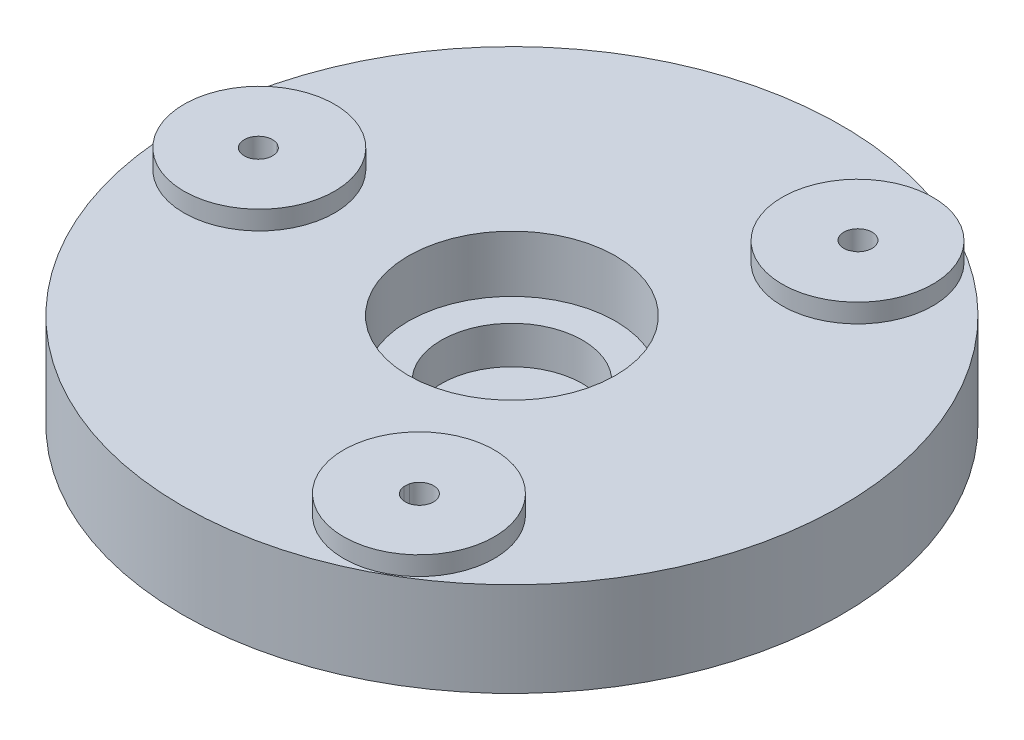
from build123d import *

# Parameters (mm, degrees)
SKETCH1_R                   = 35
BOSS_EXTRUDE1_DEPTH         = 10
SKETCH2_R                   = 11
CUT_EXTRUDE1_DEPTH          = 6
SKETCH3_R                   = 7.5
CUT_EXTRUDE2_DEPTH          = 6
SKETCH4_R                   = 8
BOSS_EXTRUDE2_DEPTH         = 2
CUT_EXTRUDE3_DEPTH          = 21
SKETCH6_R                   = 3.1
CUT_EXTRUDE4_DEPTH          = 4
CIRPATTERN1_COUNT           = 3
CIRPATTERN2_COUNT           = 3
CIRPATTERN3_COUNT           = 2
CIRPATTERN3_ANGLE           = 30
CIRPATTERN4_COUNT           = 2
CIRPATTERN4_ANGLE           = 30
CIRPATTERN5_COUNT           = 3
CIRPATTERN5_COPY_1_SKETCH_R = 3.1
CIRPATTERN5_COPY_1_DEPTH    = 4
CIRPATTERN5_COPY_2_SKETCH_R = 3.1
CIRPATTERN5_COPY_2_DEPTH    = 4
CIRPATTERN5_COPY_3_SKETCH_R = 3.1
CIRPATTERN5_COPY_3_DEPTH    = 4
CIRPATTERN5_COPY_4_SKETCH_R = 3.1
CIRPATTERN5_COPY_4_DEPTH    = 4
SKETCH7_R                   = 8.965645278
BOSS_EXTRUDE3_DEPTH         = 10
SKETCH8_W                   = 2
SKETCH8_H                   = 2
CUT_EXTRUDE5_DEPTH          = 10


with BuildPart() as part:
    # Sketch1 → Boss-Extrude1 (new body)
    with BuildSketch(Plane(origin=(0, 0, 0), x_dir=(1, 0, 0), z_dir=(0, 1, 0))):
        with Locations(Location((0, 0, 0), (0, 0, 270))):
            Circle(SKETCH1_R)
    extrude(amount=-BOSS_EXTRUDE1_DEPTH)

    # Sketch2 → Cut-Extrude1 (cut)
    with BuildSketch(Plane(origin=(0, 0, 0), x_dir=(1, 0, 0), z_dir=(0, 1, 0))):
        with Locations(Location((0, 0, 0), (0, 0, 270))):
            Circle(SKETCH2_R)
    extrude(amount=-CUT_EXTRUDE1_DEPTH, mode=Mode.SUBTRACT)

    # Sketch3 → Cut-Extrude2 (cut)
    with BuildSketch(Plane.XZ.offset(10)):
        with Locations(Location((0, 0, 0), (0, 0, 270))):
            Circle(SKETCH3_R)
    extrude(amount=-CUT_EXTRUDE2_DEPTH, mode=Mode.SUBTRACT)

    # Sketch4 → Boss-Extrude2 (add)
    with BuildSketch(Plane(origin=(0, 0, 0), x_dir=(1, 0, 0), z_dir=(0, 1, 0))):
        with Locations(Location((13.45606226, 23.245861182, 0), (0, 0, 270))):
            Circle(SKETCH4_R)
    boss_extrude2 = extrude(amount=BOSS_EXTRUDE2_DEPTH)

    # Sketch5 → Cut-Extrude3 (cut)
    with BuildSketch(Plane(origin=(0, 2, 0), x_dir=(1, 0, 0), z_dir=(0, 1, 0))):
        with BuildLine():
            Line((13.841241823, 21.865976381), (14.30157773, 22.084407474))
            ThreePointArc((14.30157773, 22.084407474), (14.769217525, 22.619952494), (14.937716007, 23.310679436))
            ThreePointArc((14.937716007, 23.310679436), (12.242875281, 24.2175177), (13.841241823, 21.865976381))
        make_face()
    cut_extrude3 = extrude(amount=-CUT_EXTRUDE3_DEPTH, mode=Mode.SUBTRACT)

    # Sketch6 → Cut-Extrude4 (cut)
    with BuildSketch(Plane.XZ.offset(10)):
        with Locations(Location((13.437716007, -23.310679436, 0), (0, 0, 270))):
            Circle(SKETCH6_R)
    cut_extrude4 = extrude(amount=-CUT_EXTRUDE4_DEPTH, mode=Mode.SUBTRACT)

    # CirPattern1: Boss-Extrude2 ×3 about axis
    cirpattern1_axis = Axis((0, 0, 0), (0, 1, 0))
    for i in range(1, CIRPATTERN1_COUNT):
        add(boss_extrude2.rotate(cirpattern1_axis, i * 360 / CIRPATTERN1_COUNT))

    # CirPattern2: Cut-Extrude3 ×3 about axis
    cirpattern2_axis = Axis((0, 0, 0), (0, 1, 0))
    for i in range(1, CIRPATTERN2_COUNT):
        add(cut_extrude3.rotate(cirpattern2_axis, i * 360 / CIRPATTERN2_COUNT), mode=Mode.SUBTRACT)

    # CirPattern3: Cut-Extrude4 ×2 about axis
    cirpattern3_axis = Axis((0, -4, 0), (0, 1, 0))
    for i in range(1, CIRPATTERN3_COUNT):
        add(cut_extrude4.rotate(cirpattern3_axis, i * CIRPATTERN3_ANGLE / (CIRPATTERN3_COUNT - 1)), mode=Mode.SUBTRACT)

    # CirPattern4: Cut-Extrude4 ×2 about axis
    cirpattern4_axis = Axis((0, -10, 0), (0, -1, 0))
    for i in range(1, CIRPATTERN4_COUNT):
        add(cut_extrude4.rotate(cirpattern4_axis, i * CIRPATTERN4_ANGLE / (CIRPATTERN4_COUNT - 1)), mode=Mode.SUBTRACT)

    # CirPattern5: Cut-Extrude4 ×3 about axis
    cirpattern5_axis = Axis((0, 0, 0), (0, 1, 0))
    for i in range(1, CIRPATTERN5_COUNT):
        add(cut_extrude4.rotate(cirpattern5_axis, i * 360 / CIRPATTERN5_COUNT), mode=Mode.SUBTRACT)

    # CirPattern5 copy 1 sketch → CirPattern5 copy 1 (cut)
    with BuildSketch(Plane(origin=(0, -10, 0), x_dir=(-0.8660254037844389, 0, -0.4999999999999994), z_dir=(0, -1, 0))):
        with Locations(Location((13.437716007, -23.310679436, 0), (0, 0, 270))):
            Circle(CIRPATTERN5_COPY_1_SKETCH_R)
    extrude(amount=-CIRPATTERN5_COPY_1_DEPTH, mode=Mode.SUBTRACT)

    # CirPattern5 copy 2 sketch → CirPattern5 copy 2 (cut)
    with BuildSketch(Plane(origin=(0, -10, 0), x_dir=(0, 0, 1), z_dir=(0, -1, 0))):
        with Locations(Location((13.437716007, -23.310679436, 0), (0, 0, 270))):
            Circle(CIRPATTERN5_COPY_2_SKETCH_R)
    extrude(amount=-CIRPATTERN5_COPY_2_DEPTH, mode=Mode.SUBTRACT)

    # CirPattern5 copy 3 sketch → CirPattern5 copy 3 (cut)
    with BuildSketch(Plane(origin=(0, -10, 0), x_dir=(0, 0, -1), z_dir=(0, -1, 0))):
        with Locations(Location((13.437716007, -23.310679436, 0), (0, 0, 270))):
            Circle(CIRPATTERN5_COPY_3_SKETCH_R)
    extrude(amount=-CIRPATTERN5_COPY_3_DEPTH, mode=Mode.SUBTRACT)

    # CirPattern5 copy 4 sketch → CirPattern5 copy 4 (cut)
    with BuildSketch(Plane(origin=(0, -10, 0), x_dir=(-0.8660254037844393, 0, 0.4999999999999987), z_dir=(0, -1, 0))):
        with Locations(Location((13.437716007, -23.310679436, 0), (0, 0, 270))):
            Circle(CIRPATTERN5_COPY_4_SKETCH_R)
    extrude(amount=-CIRPATTERN5_COPY_4_DEPTH, mode=Mode.SUBTRACT)


with BuildPart() as body_2:
    # Sketch7 → Boss-Extrude3 (new body)
    with BuildSketch(Plane.XZ.offset(10)):
        with Locations(Location((0, 0, 0), (0, 0, 270))):
            Circle(SKETCH7_R)
    extrude(amount=BOSS_EXTRUDE3_DEPTH)

    # Sketch8 → Cut-Extrude5 (cut)
    with BuildSketch(Plane.XZ.offset(20)):
        with Locations((8.965645278, 0)):
            Rectangle(SKETCH8_W, SKETCH8_H)
    extrude(amount=-CUT_EXTRUDE5_DEPTH, mode=Mode.SUBTRACT)


solid = Compound([part.part, body_2.part])
